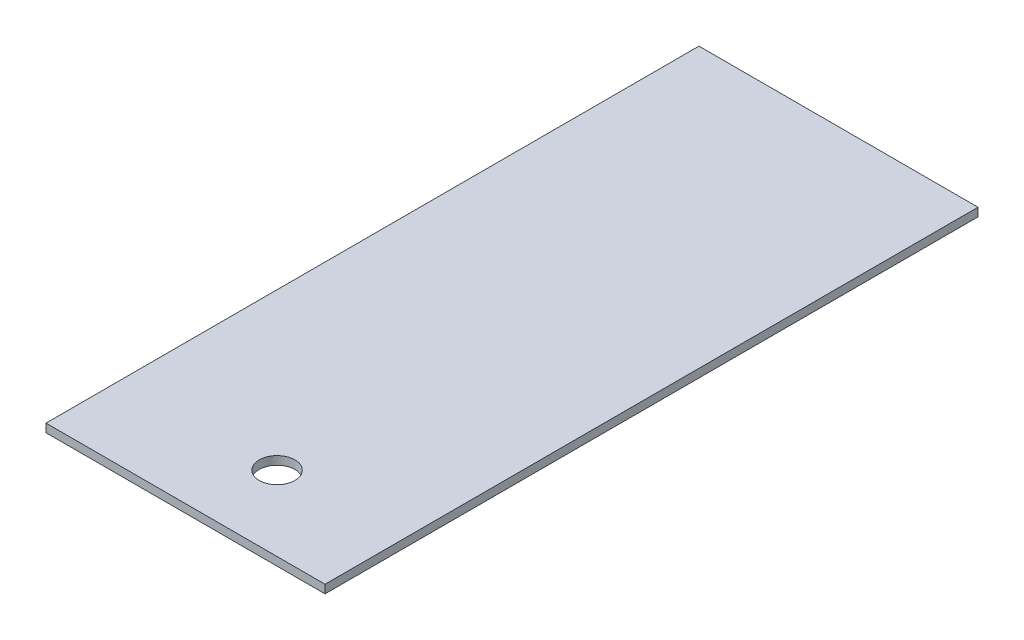
from build123d import *

# Parameters (mm, degrees)
SKETCH1_W           = 63.5
SKETCH1_H           = 148.59
BOSS_EXTRUDE1_DEPTH = 1.905
SKETCH2_R           = 4.064
CUT_EXTRUDE1_DEPTH  = 2.54


with BuildPart() as part:
    # Sketch1 → Boss-Extrude1 (new body)
    with BuildSketch(Plane(origin=(0, 0, 0), x_dir=(1, 0, 0), z_dir=(0, 1, 0))):
        with Locations((31.75, 74.295)):
            Rectangle(SKETCH1_W, SKETCH1_H)
    extrude(amount=BOSS_EXTRUDE1_DEPTH)

    # Sketch2 → Cut-Extrude1 (cut)
    with BuildSketch(Plane(origin=(0, 1.905, 0), x_dir=(1, 0, 0), z_dir=(0, 1, 0))):
        with Locations((35.56, 17.018)):
            Circle(SKETCH2_R)
    extrude(amount=-CUT_EXTRUDE1_DEPTH, mode=Mode.SUBTRACT)


solid = part.part
